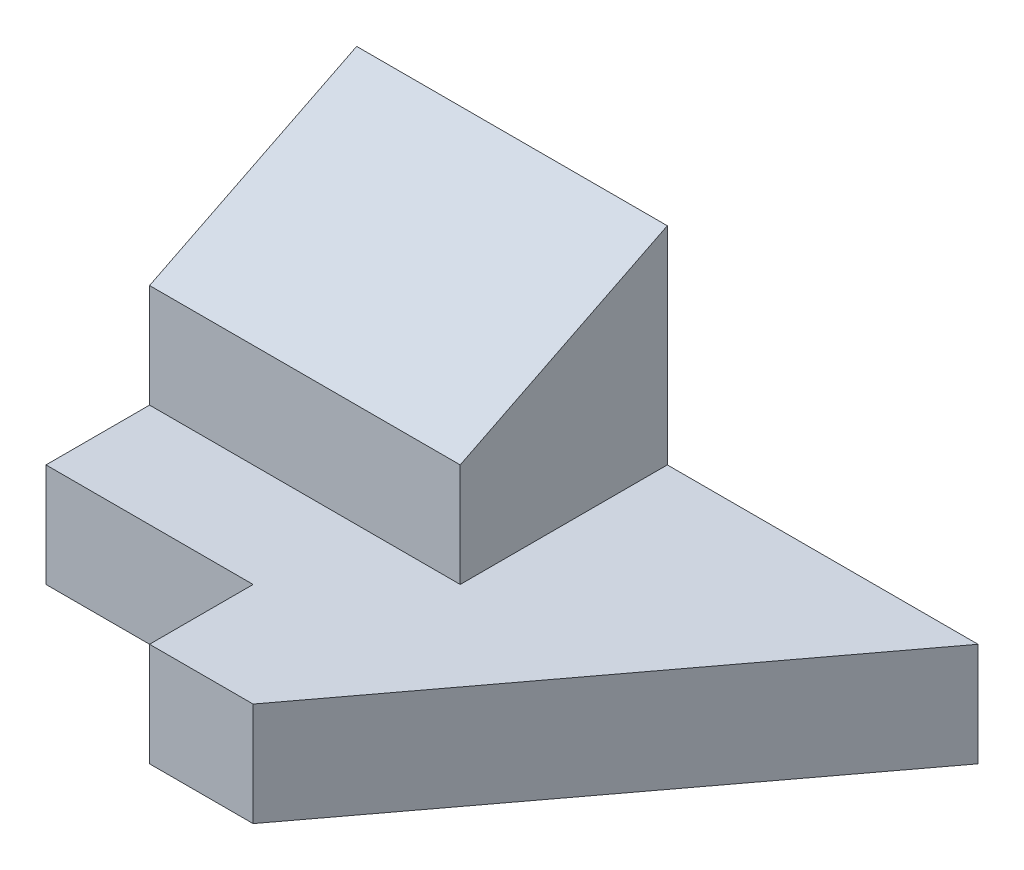
from build123d import *

# Parameters (mm, degrees)
EXTRUDE_1_DEPTH     = 10
SKETCH_1_3_W        = 30
SKETCH_1_3_H        = 20
EXTRUDE_2_DEPTH     = 30
CUT_EXTRUDE_1_DEPTH = 59


with BuildPart() as part:
    # 草圖1 → 填料-伸長1 (new body)
    with BuildSketch(Plane(origin=(0, 0, 0), x_dir=(1, 0, 0), z_dir=(0, 1, 0))):
        Polygon((-30, -40), (0, 0), (-60, 0), (-60, -30), (-40, -30), (-40, -40), align=None)
    extrude(amount=EXTRUDE_1_DEPTH)

    # 草圖1<3> → 填料-伸長2 (add)
    with BuildSketch(Plane(origin=(0, 0, 0), x_dir=(1, 0, 0), z_dir=(0, 1, 0))):
        with Locations((-45, -10)):
            Rectangle(SKETCH_1_3_W, SKETCH_1_3_H)
    extrude(amount=EXTRUDE_2_DEPTH)

    # 草圖2 → 除料-伸長1 (cut)
    with BuildSketch(Plane(origin=(-30, 0, 0), x_dir=(0, 0, -1), z_dir=(1, 0, 0))):
        Polygon((0, 30), (-20, 20), (-20, 30), align=None)
    extrude(amount=-CUT_EXTRUDE_1_DEPTH, mode=Mode.SUBTRACT)


solid = part.part
